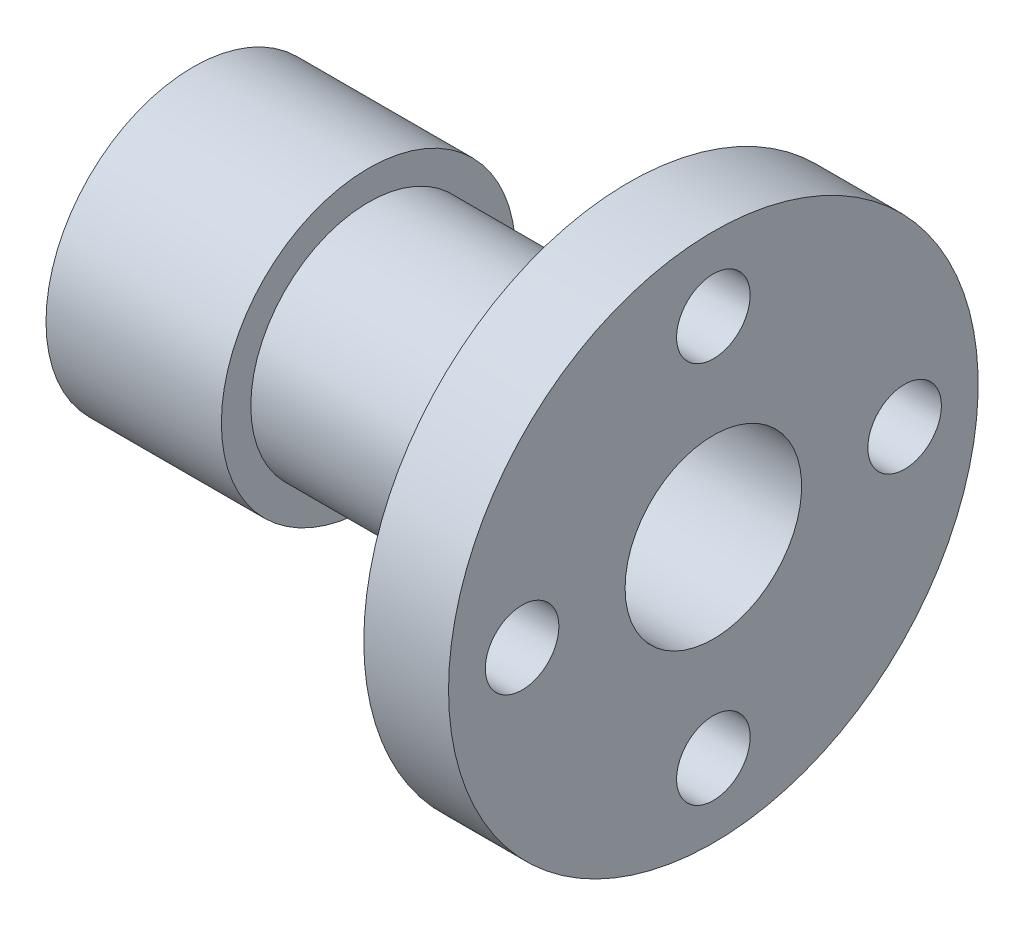
from build123d import *

# Parameters (mm, degrees)
SKETCH2_R          = 6.25
CUT_EXTRUDE1_DEPTH = 109.92456105


with BuildPart() as part:
    # Sketch1 → Revolve1 (revolve)
    with BuildSketch(Plane(origin=(0, 0, 0), x_dir=(1, 0, 0), z_dir=(0, 1, 0)), mode=Mode.PRIVATE) as revolve1_sk:
        Polygon((-44.2, 25), (-14.4, 25), (-14.4, 20), (29.8, 20), (29.8, 45), (44.2, 45), (44.2, 15), (20.4, 15), (-20.4, 15), (-20.2, 19), (-44.2, 19), align=None)
    revolve(revolve1_sk.sketch.rotate(Axis((-44.2, 0, 0), (1, 0, 0)), 180), axis=Axis((-44.2, 0, 0), (1, 0, 0)))

    # Sketch2 → Cut-Extrude1 (cut, through all)
    with BuildSketch(Plane(origin=(44.2, 0, 0), x_dir=(0, 0, -1), z_dir=(1, 0, 0))):
        with Locations((0, 32.5)):
            Circle(SKETCH2_R)
        with Locations((32.5, 0)):
            Circle(SKETCH2_R)
        with Locations((0, -32.5)):
            Circle(SKETCH2_R)
        with Locations((-32.5, 0)):
            Circle(SKETCH2_R)
    extrude(amount=-CUT_EXTRUDE1_DEPTH, mode=Mode.SUBTRACT)


solid = part.part
